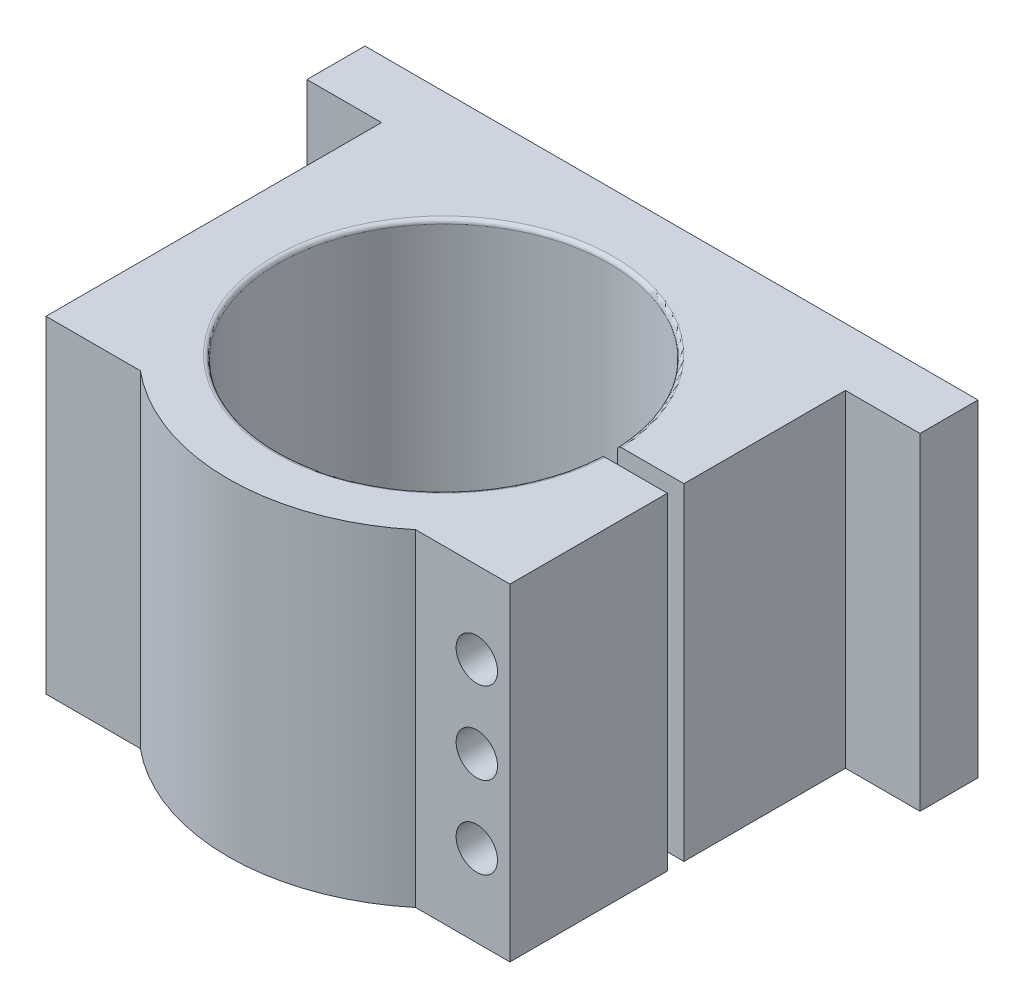
from build123d import *

# Parameters (mm, degrees)
SKETCH1_W           = 148
SKETCH1_H           = 79
BOSS_EXTRUDE1_DEPTH = 14
SKETCH2_W           = 112
SKETCH2_H           = 79
BOSS_EXTRUDE2_DEPTH = 93
SKETCH3_R           = 40
CUT_EXTRUDE1_DEPTH  = 80
CUT_EXTRUDE2_DEPTH  = 80
CUT_EXTRUDE4_DEPTH  = 80
SKETCH9_R           = 3
CUT_EXTRUDE5_DEPTH  = 60
SKETCH10_R          = 5
CUT_EXTRUDE6_DEPTH  = 10
FILLET1_R           = 1


with BuildPart() as part:
    # Sketch1 → Boss-Extrude1 (new body)
    with BuildSketch(Plane.XY):
        Rectangle(SKETCH1_W, SKETCH1_H)
    extrude(amount=BOSS_EXTRUDE1_DEPTH)

    # Sketch2 → Boss-Extrude2 (add)
    with BuildSketch(Plane.XY.offset(14)):
        Rectangle(SKETCH2_W, SKETCH2_H)
    extrude(amount=BOSS_EXTRUDE2_DEPTH)

    # Sketch3 → Cut-Extrude1 (cut)
    with BuildSketch(Plane(origin=(0, 39.5, 0), x_dir=(1, 0, 0), z_dir=(0, 1, 0))):
        with Locations(Location((0, -55, 0), (0, 0, 270))):
            Circle(SKETCH3_R)
    extrude(amount=-CUT_EXTRUDE1_DEPTH, mode=Mode.SUBTRACT)

    # Sketch6 → Cut-Extrude2 (cut)
    with BuildSketch(Plane(origin=(0, 39.5, 0), x_dir=(1, 0, 0), z_dir=(0, 1, 0))):
        with BuildLine():
            ThreePointArc((0, -107), (-17.663521733, -103.908077043), (-33.226495452, -95))
            Line((-33.226495452, -95), (-56, -95))
            Line((-56, -95), (-56, -107))
            Line((-56, -107), (0, -107))
        make_face()
        with BuildLine():
            ThreePointArc((33.226495452, -95), (17.663521733, -103.908077043), (0, -107))
            Line((0, -107), (56, -107))
            Line((56, -107), (56, -95))
            Line((56, -95), (33.226495452, -95))
        make_face()
    extrude(amount=-CUT_EXTRUDE2_DEPTH, mode=Mode.SUBTRACT)

    # Sketch8 → Cut-Extrude4 (cut)
    with BuildSketch(Plane(origin=(0, 39.5, 0), x_dir=(1, 0, 0), z_dir=(0, 1, 0))):
        Polygon((56, -55), (56, -57), (38.221026174, -57), (38.221026174, -53), (56, -53), align=None)
    extrude(amount=-CUT_EXTRUDE4_DEPTH, mode=Mode.SUBTRACT)

    # Sketch9 → Cut-Extrude5 (cut)
    with BuildSketch(Plane.XY.offset(95)):
        with Locations((48, 19.75)):
            Circle(SKETCH9_R)
        with Locations((48, 0)):
            Circle(SKETCH9_R)
        with Locations((48, -19.75)):
            Circle(SKETCH9_R)
    extrude(amount=-CUT_EXTRUDE5_DEPTH, mode=Mode.SUBTRACT)

    # Sketch10 → Cut-Extrude6 (cut)
    with BuildSketch(Plane.XY.offset(95)):
        with Locations((48, 19.75)):
            Circle(SKETCH10_R)
        with Locations((48, 0)):
            Circle(SKETCH10_R)
        with Locations((48, -19.75)):
            Circle(SKETCH10_R)
    extrude(amount=-CUT_EXTRUDE6_DEPTH, mode=Mode.SUBTRACT)

    # Fillet1
    fillet1_edges = [part.edges().sort_by_distance(p)[0] for p in [
        (-28.982753492, 39.5, 27.431902496),
        (-28.982753492, -39.5, 27.431902496),
    ]]
    fillet(fillet1_edges, radius=FILLET1_R)


solid = part.part
